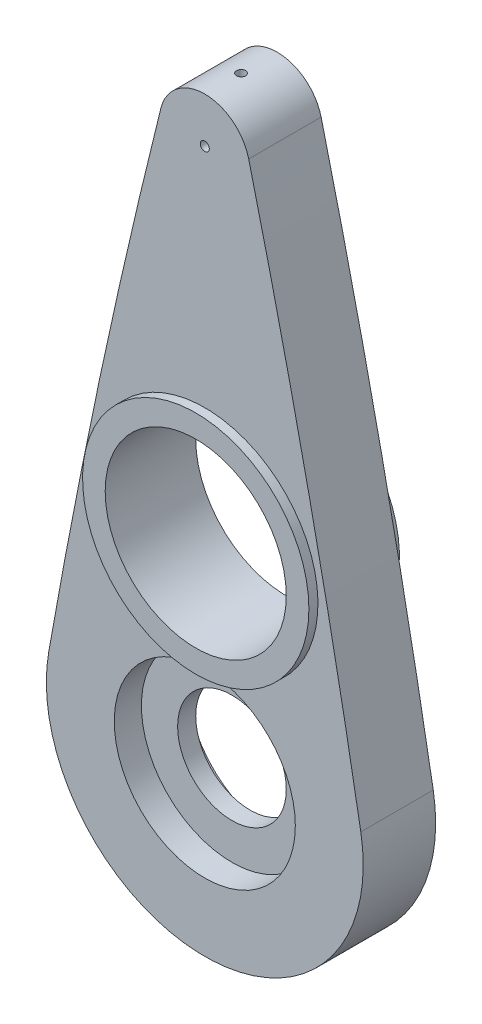
from build123d import *

# Parameters (mm, degrees)
SKETCH_1_R               = 6
EXTRUDE_2_DEPTH          = 8
CUT_EXTRUDE_START        = -3
SKETCH_2_R               = 10
SKETCH_2_R_2             = 6
CUT_EXTRUDE_1_DEPTH      = 3
SKETCH_3_R               = 10
SKETCH_3_R_2             = 6
CUT_EXTRUDE_2_DEPTH      = 3
SKETCH_5_R               = 0.5
CUT_EXTRUDE_3_DEPTH      = 68.788273322
SKETCH_6_R               = 10
CUT_EXTRUDE_4_DEPTH      = 68.788273322
EXTRUDE_START            = 1
SKETCH_7_R               = 12.5
SKETCH_7_R_2             = 10
EXTRUDE_3_DEPTH          = 1
SKETCH_8_R               = 12.5
SKETCH_8_R_2             = 10
EXTRUDE_4_DEPTH          = 1
CUT_EXTRUDE_5_REACH      = 86.815
CUT_EXTRUDE_5_END_RADIUS = 0.5
SKETCH_10_R              = 0.5


with BuildPart() as part:
    # 草图1 → 凸台-拉伸2 (new body)
    with BuildSketch(Plane.XY):
        with BuildLine():
            ThreePointArc((4.850754193, 61.212511345), (0, 65), (-4.850754193, 61.212511345))
            ThreePointArc((-4.850754193, 61.212511345), (-11.55450868, 32.234679821), (-17.234135678, 3.038843109))
            ThreePointArc((-17.234135678, 3.038843109), (0, -17.5), (17.234135678, 3.038843109))
            ThreePointArc((17.234135678, 3.038843109), (11.55450868, 32.234679821), (4.850754193, 61.212511345))
        make_face()
        Circle(SKETCH_1_R, mode=Mode.SUBTRACT)
    extrude(amount=EXTRUDE_2_DEPTH)

    # 草图2 → 切除-拉伸1 (cut)
    with BuildSketch(Plane.XY.offset(8).offset(CUT_EXTRUDE_START)):
        Circle(SKETCH_2_R)
        Circle(SKETCH_2_R_2, mode=Mode.SUBTRACT)
    extrude(amount=CUT_EXTRUDE_1_DEPTH, mode=Mode.SUBTRACT)

    # 草图3 → 切除-拉伸2 (cut)
    with BuildSketch(Plane(origin=(0, 0, 0), x_dir=(-1, 0, 0), z_dir=(0, 0, -1))):
        with Locations(Location((0, 0, 0), (0, 0, 180))):
            Circle(SKETCH_3_R)
        Circle(SKETCH_3_R_2, mode=Mode.SUBTRACT)
    extrude(amount=-CUT_EXTRUDE_2_DEPTH, mode=Mode.SUBTRACT)

    # 草图5 → 切除-拉伸3 (cut, through all)
    with BuildSketch(Plane(origin=(0, 0, 0), x_dir=(-1, 0, 0), z_dir=(0, 0, -1))):
        with Locations((0, 60)):
            Circle(SKETCH_5_R)
    extrude(amount=-CUT_EXTRUDE_3_DEPTH, mode=Mode.SUBTRACT)

    # 草图6 → 切除-拉伸4 (cut, through all)
    with BuildSketch(Plane(origin=(0, 0, 0), x_dir=(-1, 0, 0), z_dir=(0, 0, -1))):
        with Locations((0, 22.5)):
            Circle(SKETCH_6_R)
    extrude(amount=-CUT_EXTRUDE_4_DEPTH, mode=Mode.SUBTRACT)

    # 草图7 → 凸台-拉伸3 (add)
    with BuildSketch(Plane(origin=(0, 0, 0), x_dir=(-1, 0, 0), z_dir=(0, 0, -1)).offset(EXTRUDE_START)):
        with Locations(Location((0, 22.5, 0), (0, 0, 270))):
            Circle(SKETCH_7_R)
        with Locations((0, 22.5)):
            Circle(SKETCH_7_R_2, mode=Mode.SUBTRACT)
    extrude(amount=-EXTRUDE_3_DEPTH)

    # 草图8 → 凸台-拉伸4 (add)
    with BuildSketch(Plane.XY.offset(8)):
        with Locations(Location((0, 22.5, 0), (0, 0, 270))):
            Circle(SKETCH_8_R)
        with Locations(Location((0, 22.5, 0), (0, 0, 180))):
            Circle(SKETCH_8_R_2, mode=Mode.SUBTRACT)
    extrude(amount=EXTRUDE_4_DEPTH)

    # 切除-拉伸5: up to this cylinder (the profile starts outside it)
    cut_extrude_5_end = Plane(origin=(0, 60, 4), z_dir=(0, 0, -1)) * Cylinder(CUT_EXTRUDE_5_END_RADIUS, 175.63, mode=Mode.PRIVATE)
    # 草图10 → 切除-拉伸5 (cut, up to the surface)
    with BuildSketch(Plane(origin=(0, 65, 0), x_dir=(1, 0, 0), z_dir=(0, 1, 0)), mode=Mode.PRIVATE) as cut_extrude_5_sk1:
        with Locations(Location((0, -4, 0), (0, 0, 180))):
            Circle(SKETCH_10_R)
    cut_extrude_5_tool1 = extrude(cut_extrude_5_sk1.sketch, amount=-CUT_EXTRUDE_5_REACH, mode=Mode.PRIVATE) - cut_extrude_5_end
    add(cut_extrude_5_tool1.solids().sort_by_distance((0, 65, 4))[0], mode=Mode.SUBTRACT)


solid = part.part
